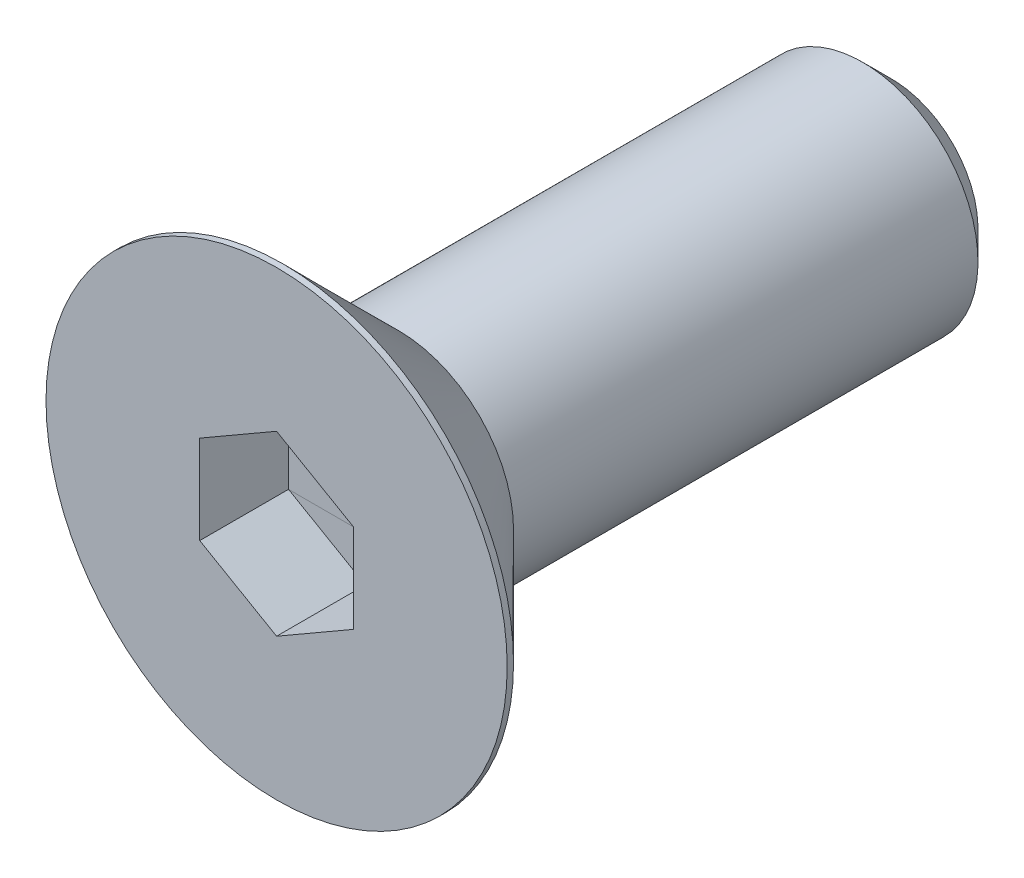
from build123d import *

# Parameters (mm, degrees)
CHAMFER1_SIZE      = 0.75
CUT_EXTRUDE2_DEPTH = 2.31


with BuildPart() as part:
    # Sketch1 → Revolve1 (revolve)
    with BuildSketch(Plane(origin=(0, 0, 0), x_dir=(0, 0, -1), z_dir=(1, 0, 0))):
        Polygon((-4.7, 3), (8, 3), (8, 0), (-5.69, 0), (-5.69, 3), align=None)
    revolve(axis=Axis((0, 0, 5.69), (0, 0, -1)))

    # Chamfer1
    chamfer1_edges = [part.edges().sort_by_distance(p)[0] for p in [
        (0, -3, -8),
    ]]
    chamfer(chamfer1_edges, length=CHAMFER1_SIZE)


with BuildPart() as body_2:
    # Sketch7 → Revolve2 (revolve)
    with BuildSketch(Plane(origin=(0, 0, 0), x_dir=(0, 0, -1), z_dir=(1, 0, 0))):
        Polygon((-7.835, 6), (-8, 6), (-8, 0), (-4.7, 0), (-4.7, 2.865), align=None)
    revolve(axis=Axis((0, 0, 8), (0, 0, -1)))

    # Sketch5 → Cut-Extrude2 (cut)
    with BuildSketch(Plane.XY.offset(8)):
        Polygon((2, -1.154700538), (2, 1.154700538), (0, 2.309401077), (-2, 1.154700538), (-2, -1.154700538), (0, -2.309401077), align=None)
    extrude(amount=-CUT_EXTRUDE2_DEPTH, mode=Mode.SUBTRACT)


solid = Compound([part.part, body_2.part])
